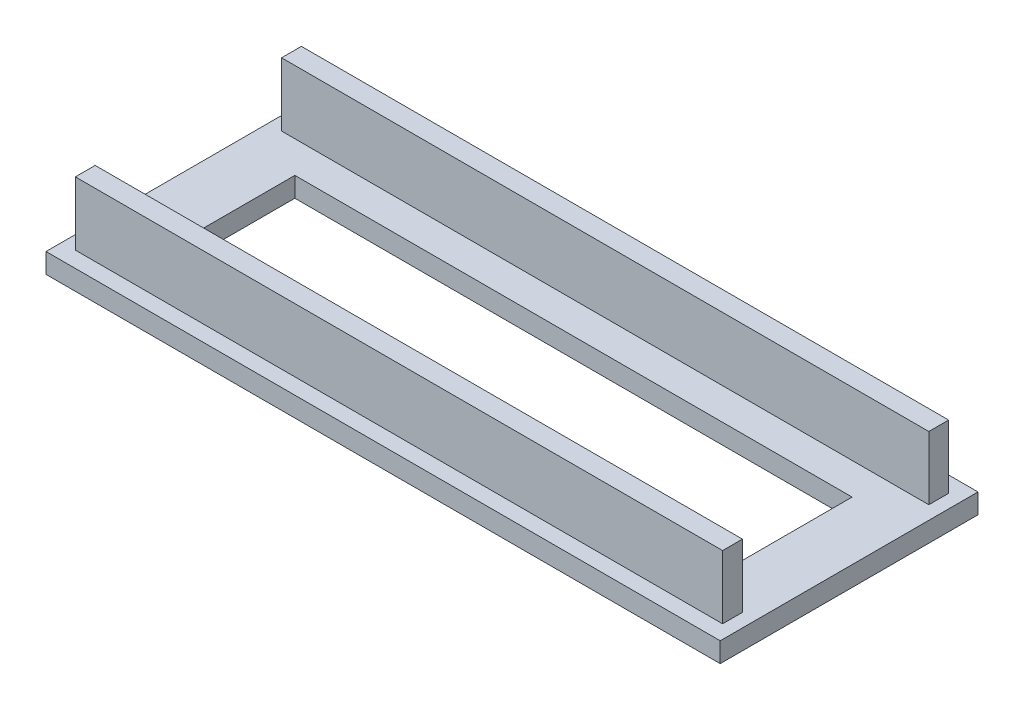
from build123d import *

# Parameters (mm, degrees)
F_01_RAIL_BASE_PROFILE_W   = 340
F_01_RAIL_BASE_PROFILE_H   = 130
F_01_RAIL_BASE_PROFILE_R   = 4.5
F_01_RAIL_BASE_PROFILE_W_2 = 281
F_01_RAIL_BASE_PROFILE_H_2 = 62
F_01_RAIL_BASE_DEPTH       = 10
F_02_GUIDE_RAIL_PROFILES_W = 326.4
F_02_GUIDE_RAIL_PROFILES_H = 10
F_02_GUIDE_RAILS_DEPTH     = 42


with BuildPart() as part:
    # 01_Rail_Base_Profile → 01_Rail_Base (new body)
    with BuildSketch(Plane(origin=(0, 0, 0), x_dir=(1, 0, 0), z_dir=(0, 1, 0))):
        Rectangle(F_01_RAIL_BASE_PROFILE_W, F_01_RAIL_BASE_PROFILE_H)
        with Locations(Location((-145, -52, 0), (0, 0, 270))):
            Circle(F_01_RAIL_BASE_PROFILE_R, mode=Mode.SUBTRACT)
        with Locations(Location((-145, 52, 0), (0, 0, 270))):
            Circle(F_01_RAIL_BASE_PROFILE_R, mode=Mode.SUBTRACT)
        with Locations(Location((145, -52, 0), (0, 0, 270))):
            Circle(F_01_RAIL_BASE_PROFILE_R, mode=Mode.SUBTRACT)
        with Locations(Location((145, 52, 0), (0, 0, 270))):
            Circle(F_01_RAIL_BASE_PROFILE_R, mode=Mode.SUBTRACT)
        Rectangle(F_01_RAIL_BASE_PROFILE_W_2, F_01_RAIL_BASE_PROFILE_H_2, mode=Mode.SUBTRACT)
    extrude(amount=F_01_RAIL_BASE_DEPTH)

    # 02_Guide_Rail_Profiles → 02_Guide_Rails (add)
    with BuildSketch(Plane(origin=(0, 0, 0), x_dir=(1, 0, 0), z_dir=(0, 1, 0))):
        with Locations((0, 52)):
            Rectangle(F_02_GUIDE_RAIL_PROFILES_W, F_02_GUIDE_RAIL_PROFILES_H)
        with Locations((0, -52)):
            Rectangle(F_02_GUIDE_RAIL_PROFILES_W, F_02_GUIDE_RAIL_PROFILES_H)
    extrude(amount=F_02_GUIDE_RAILS_DEPTH)


solid = part.part
